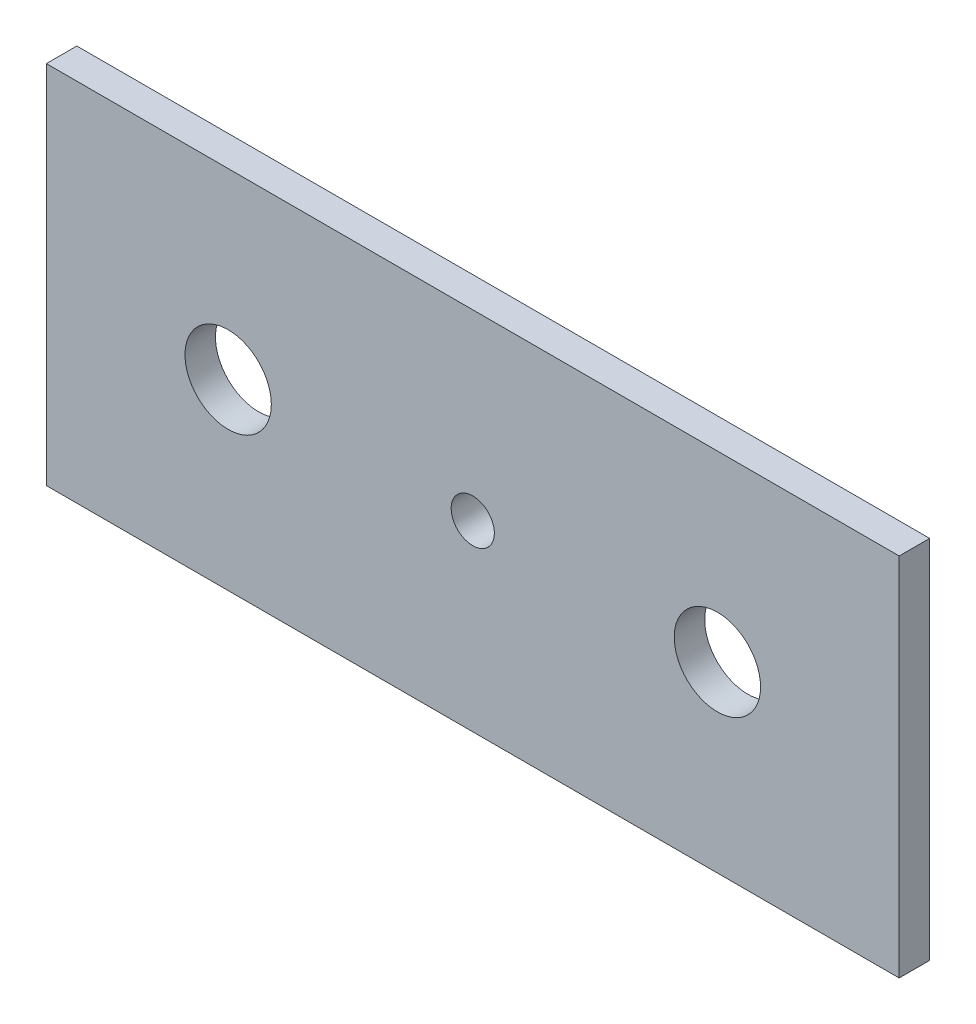
from build123d import *

# Parameters (mm, degrees)
SKETCH1_W            = 88.9
SKETCH1_H            = 38.1
BOSS_EXTRUDE1_DEPTH  = 3.175
M4_CLEARANCE_HOLE1_D = 4.5
M8_CLEARANCE_HOLE1_D = 9


with BuildPart() as part:
    # Sketch1 → Boss-Extrude1 (new body)
    with BuildSketch(Plane.XY):
        Rectangle(SKETCH1_W, SKETCH1_H)
    extrude(amount=-BOSS_EXTRUDE1_DEPTH)

    # M4 Clearance Hole1 (through all)
    with Locations(Plane.XY):
        with Locations((0, 0)):
            Hole(M4_CLEARANCE_HOLE1_D / 2)

    # M8 Clearance Hole1 (through all)
    with Locations(Plane.XY):
        with Locations((-25.5, 0), (25.5, 0)):
            Hole(M8_CLEARANCE_HOLE1_D / 2)


solid = part.part
